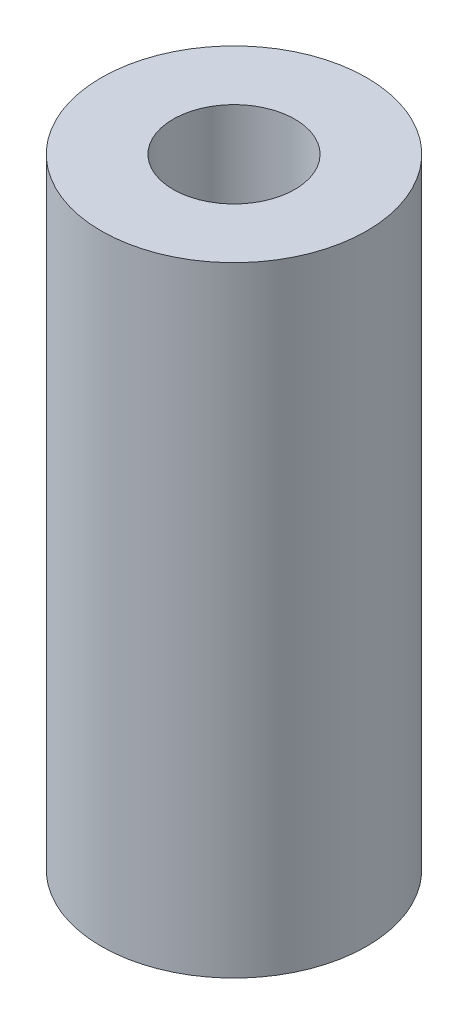
from build123d import *

# Parameters (mm, degrees)
SKETCH1_R           = 4.7625
SKETCH1_R_2         = 2.1844
BOSS_EXTRUDE1_DEPTH = 22.225


with BuildPart() as part:
    # Sketch1 → Boss-Extrude1 (new body)
    with BuildSketch(Plane(origin=(0, 0, 0), x_dir=(1, 0, 0), z_dir=(0, 1, 0))):
        with Locations(Location((0, 0, 0), (0, 0, 270))):
            Circle(SKETCH1_R)
        with Locations(Location((0, 0, 0), (0, 0, 270))):
            Circle(SKETCH1_R_2, mode=Mode.SUBTRACT)
    extrude(amount=BOSS_EXTRUDE1_DEPTH)


solid = part.part
